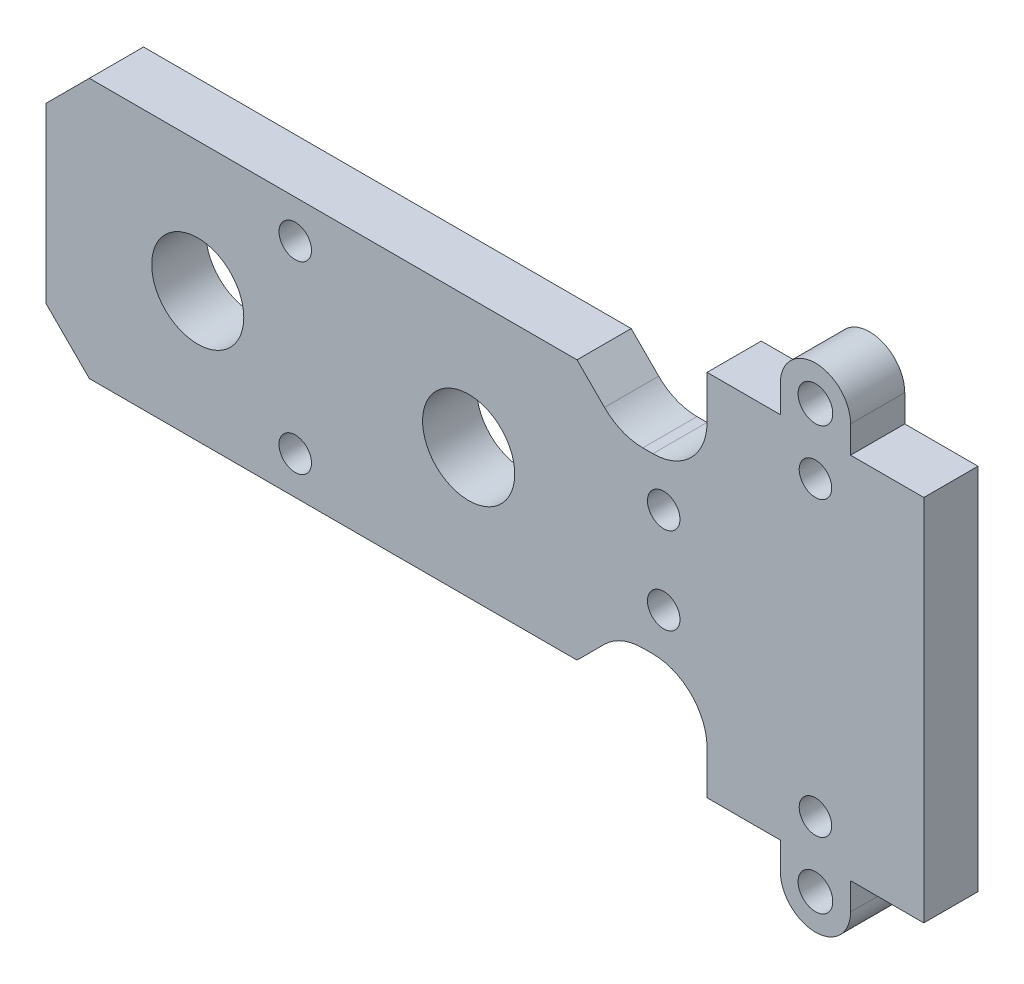
from build123d import *

# Parameters (mm, degrees)
ESQUISSE1_R             = 4.25
ESQUISSE1_R_2           = 1.5
BOSS_EXTRU_1_DEPTH      = 5
ESQUISSE2_R             = 1.5
ESQUISSE2_R_2           = 1.6
BOSS_EXTRU_2_DEPTH      = 5
CONG_1_R                = 1
ENL_V_MAT_EXTRU_1_DEPTH = 10.5
CONG_2_R                = 5


with BuildPart() as part:
    # Esquisse1 → Boss.-Extru.1 (new body)
    with BuildSketch(Plane.XY):
        with BuildLine():
            Line((30.5, 0), (30.5, 3))
            ThreePointArc((30.5, 3), (29.035533906, 6.535533906), (25.5, 8))
            Line((25.5, 8), (22.5, 8))
            Line((22.5, 8), (18.5, 12))
            Line((18.5, 12), (-26.5, 12))
            Line((-26.5, 12), (-30.5, 8))
            Line((-30.5, 8), (-30.5, 0))
            Line((-30.5, 0), (-30.5, -8))
            Line((-30.5, -8), (-26.5, -12))
            Line((-26.5, -12), (18.5, -12))
            Line((18.5, -12), (22.5, -8))
            Line((22.5, -8), (25.5, -8))
            ThreePointArc((25.5, -8), (29.035533906, -6.535533906), (30.5, -3))
            Line((30.5, -3), (30.5, 0))
        make_face()
        with Locations((-16.5, 0)):
            Circle(ESQUISSE1_R, mode=Mode.SUBTRACT)
        with Locations((-7.5, -8.5)):
            Circle(ESQUISSE1_R_2, mode=Mode.SUBTRACT)
        with Locations((8.5, 0)):
            Circle(ESQUISSE1_R, mode=Mode.SUBTRACT)
        with Locations((-7.5, 8.5)):
            Circle(ESQUISSE1_R_2, mode=Mode.SUBTRACT)
        with Locations((26.5, 4)):
            Circle(ESQUISSE1_R_2, mode=Mode.SUBTRACT)
        with Locations((26.5, -4)):
            Circle(ESQUISSE1_R_2, mode=Mode.SUBTRACT)
    extrude(amount=BOSS_EXTRU_1_DEPTH)

    # Esquisse2 → Boss.-Extru.2 (add)
    with BuildSketch(Plane(origin=(0, 0, 0), x_dir=(-1, 0, 0), z_dir=(0, 0, -1))):
        with BuildLine():
            Line((-30.5, 17), (-30.5, 8))
            Line((-30.5, 8), (-25.5, 8))
            ThreePointArc((-25.5, 8), (-29.035533906, 6.535533906), (-30.5, 3))
            Line((-30.5, 3), (-30.5, -3))
            ThreePointArc((-30.5, -3), (-29.035533906, -6.535533906), (-25.5, -8))
            Line((-25.5, -8), (-30.5, -8))
            Line((-30.5, -8), (-30.5, -16))
            Line((-30.5, -16), (-30.5, -17))
            Line((-30.5, -17), (-36.257359313, -17))
            Line((-36.257359313, -17), (-36.257359313, -21))
            ThreePointArc((-36.257359313, -21), (-40.5, -24), (-44.742640687, -21))
            Line((-44.742640687, -21), (-44.742640687, -17))
            Line((-44.742640687, -17), (-50.5, -17))
            Line((-50.5, -17), (-50.5, 17))
            Line((-50.5, 17), (-44.742640687, 17))
            Line((-44.742640687, 17), (-44.742640687, 21))
            ThreePointArc((-44.742640687, 21), (-40.5, 24), (-36.257359313, 21))
            Line((-36.257359313, 21), (-36.257359313, 17))
            Line((-36.257359313, 17), (-30.5, 17))
        make_face()
        with Locations((-40.5, 13.5)):
            Circle(ESQUISSE2_R, mode=Mode.SUBTRACT)
        with Locations((-40.5, -13.5)):
            Circle(ESQUISSE2_R, mode=Mode.SUBTRACT)
        with Locations((-40.5, 19.5)):
            Circle(ESQUISSE2_R_2, mode=Mode.SUBTRACT)
        with Locations((-40.5, -19.5)):
            Circle(ESQUISSE2_R_2, mode=Mode.SUBTRACT)
    extrude(amount=-BOSS_EXTRU_2_DEPTH)

    # Congé1
    cong_1_edges = [part.edges().sort_by_distance(p)[0] for p in [
        (44.742640687, -21, 2.5),
    ]]
    fillet(cong_1_edges, radius=CONG_1_R)

    # Esquisse5 → Enlèv. mat.-Extru.1 (cut)
    with BuildSketch(Plane.XY.offset(5)):
        with BuildLine():
            Line((37.257359313, 17), (37.257359313, 19.5))
            ThreePointArc((37.257359313, 19.5), (40.5, 22.742640687), (43.742640687, 19.5))
            Line((43.742640687, 19.5), (43.742640687, 17))
            Line((43.742640687, 17), (46.702112937, 17))
            Line((46.702112937, 17), (46.702112937, 27.914494418))
            Line((46.702112937, 27.914494418), (36.257359313, 27.914494418))
            Line((36.257359313, 27.914494418), (36.257359313, 17))
            Line((36.257359313, 17), (37.257359313, 17))
        make_face()
        with BuildLine():
            Line((43.742640687, -19.5), (43.742640687, -17))
            Line((43.742640687, -17), (44.742640687, -17))
            Line((44.742640687, -17), (44.742640687, -31.949987741))
            Line((44.742640687, -31.949987741), (43.742640687, -31.949987741))
            Line((43.742640687, -31.949987741), (37.257359313, -31.949987741))
            Line((37.257359313, -31.949987741), (34.849139441, -17))
            Line((34.849139441, -17), (37.257359313, -17))
            Line((37.257359313, -17), (37.257359313, -19.5))
            ThreePointArc((37.257359313, -19.5), (40.5, -22.742640687), (43.742640687, -19.5))
        make_face()
    extrude(amount=-ENL_V_MAT_EXTRU_1_DEPTH, mode=Mode.SUBTRACT)

    # Congé2
    cong_2_edges = [part.edges().sort_by_distance(p)[0] for p in [
        (22.5, -8, 2.5),
        (22.5, 8, 2.5),
        (30.5, 8, 2.5),
        (30.5, -8, 2.5),
    ]]
    fillet(cong_2_edges, radius=CONG_2_R)


solid = part.part
